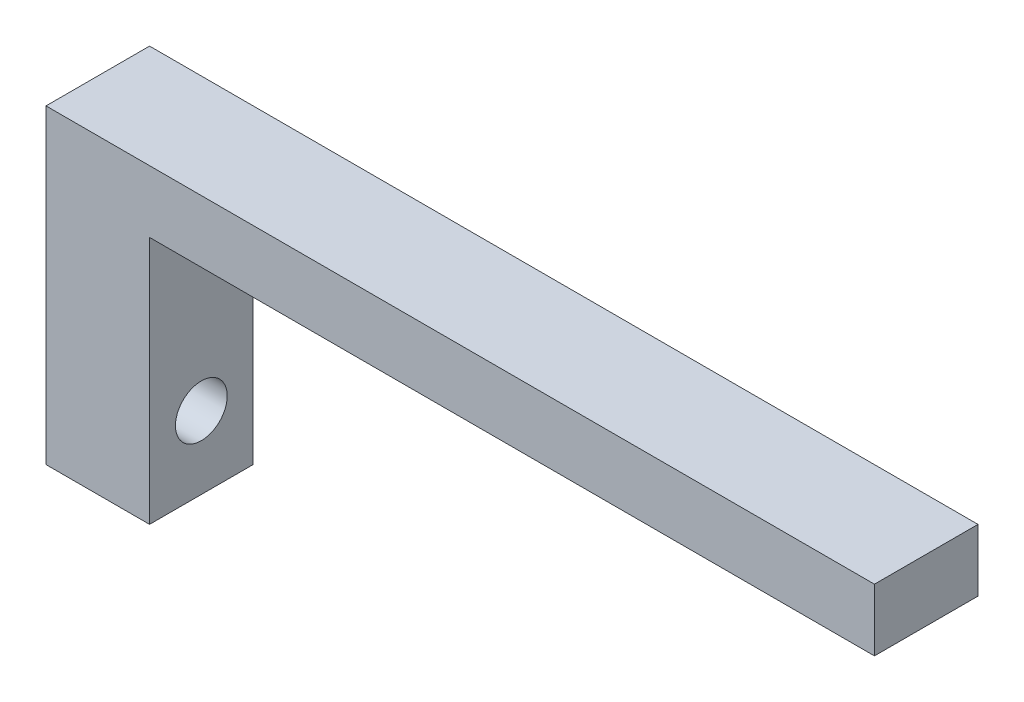
from build123d import *

# Parameters (mm, degrees)
BOSS_EXTRUDE1_DEPTH   = 2.5
M3_TAPPED_HOLE1_D     = 2.5
M3_TAPPED_HOLE1_DEPTH = 13.5
M3_TAPPED_HOLE1_TIP   = 0.751075774


with BuildPart() as part:
    # Sketch1 → Boss-Extrude1 (new, symmetric)
    with BuildSketch(Plane.XY):
        Polygon((40, 7.5), (0, 7.5), (0, -7.5), (5, -7.5), (5, 4.5), (40, 4.5), align=None)
    extrude(amount=BOSS_EXTRUDE1_DEPTH, both=True)

    # M3 Tapped Hole1
    with Locations(Plane.ZY):
        with Locations((0, -4), (0, 4)):
            Hole(M3_TAPPED_HOLE1_D / 2, depth=M3_TAPPED_HOLE1_DEPTH)
            with Locations((0, 0, -(M3_TAPPED_HOLE1_DEPTH + M3_TAPPED_HOLE1_TIP / 2))):  # 118° drill point
                Cone(0, M3_TAPPED_HOLE1_D / 2, M3_TAPPED_HOLE1_TIP, mode=Mode.SUBTRACT)


solid = part.part
